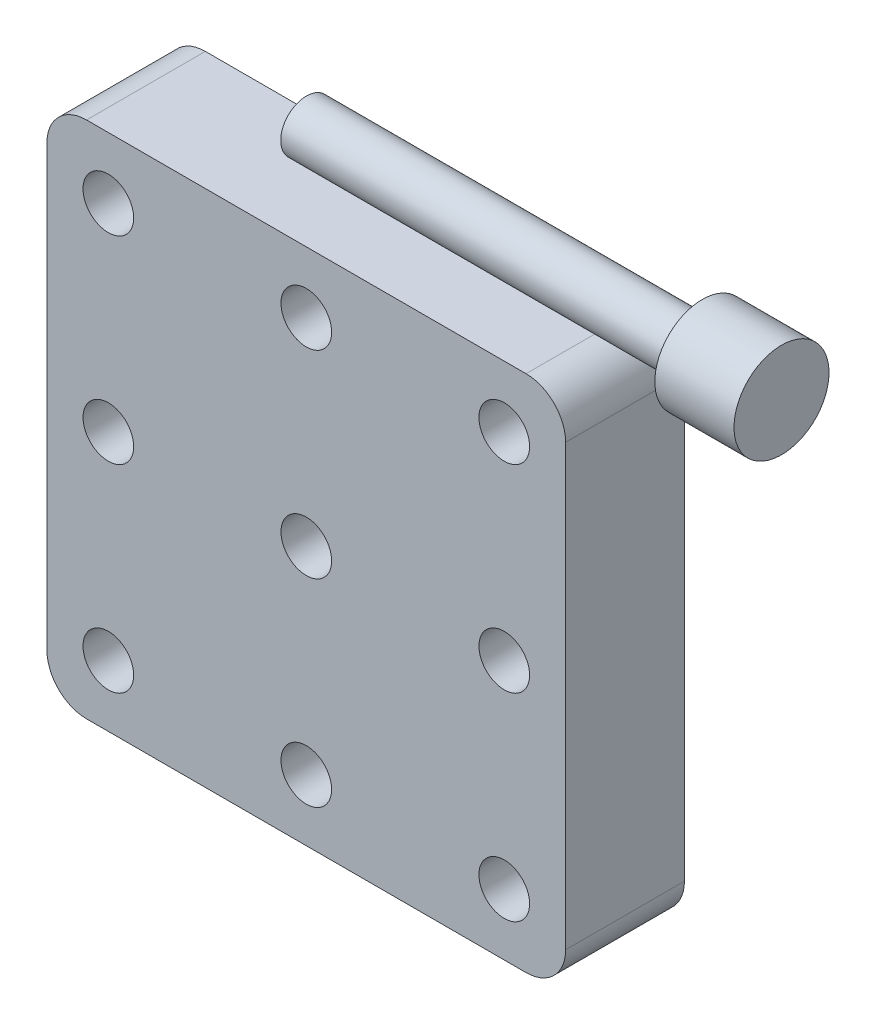
from build123d import *

# Parameters (mm, degrees)
SKETCH_1_W           = 65.5
SKETCH_1_H           = 65.5
EXTRUDE_1_DEPTH      = 20
FILLET_1_R           = 5
EXTRUDE_2_DEPTH      = 40
EXTRUDE_2_DEPTH_BACK = 10
SKETCH_5_R           = 3.245044742
SKETCH_6_R           = 6
EXTRUDE_3_DEPTH      = 10
SKETCH_7_R           = 3.2
CUT_EXTRUDE_2_DEPTH  = 5
CUT_EXTRUDE_START    = -15
SKETCH_3_R           = 3.2
CUT_EXTRUDE_3_DEPTH  = 15
SKETCH_9_W           = 65.5
SKETCH_9_H           = 65.5
CUT_EXTRUDE_5_DEPTH  = 5


with BuildPart() as part:
    # 스케치1 → 보스-돌출1 (new body)
    with BuildSketch(Plane.XY):
        Rectangle(SKETCH_1_W, SKETCH_1_H)
    extrude(amount=EXTRUDE_1_DEPTH)

    # 필렛1
    fillet_1_edges = [part.edges().sort_by_distance(p)[0] for p in [
        (-32.75, -32.75, 10),
        (32.75, -32.75, 10),
        (32.75, 32.75, 10),
        (-32.75, 32.75, 10),
    ]]
    fillet(fillet_1_edges, radius=FILLET_1_R)

    # 스케치7 → 컷-돌출2 (cut)
    with BuildSketch(Plane(origin=(0, 0, 0), x_dir=(-1, 0, 0), z_dir=(0, 0, -1))):
        with Locations((-25, -25)):
            Circle(SKETCH_7_R)
        with Locations((-25, 25)):
            Circle(SKETCH_7_R)
    extrude(amount=-CUT_EXTRUDE_2_DEPTH, mode=Mode.SUBTRACT)

    # 스케치3 → 컷-돌출3 (cut)
    with BuildSketch(Plane.XY.offset(20).offset(CUT_EXTRUDE_START)):
        with Locations(Location((25, -25, 0), (0, 0, 180))):
            Circle(SKETCH_3_R)
        with Locations(Location((25, 25, 0), (0, 0, 180))):
            Circle(SKETCH_3_R)
        with Locations((25, 0)):
            Circle(SKETCH_3_R)
        with Locations((0, -25)):
            Circle(SKETCH_3_R)
        with Locations((0, 25)):
            Circle(SKETCH_3_R)
        Circle(SKETCH_3_R)
        with Locations((-25, -25)):
            Circle(SKETCH_3_R)
        with Locations((-25, 25)):
            Circle(SKETCH_3_R)
        with Locations((-25, 0)):
            Circle(SKETCH_3_R)
    extrude(amount=CUT_EXTRUDE_3_DEPTH, mode=Mode.SUBTRACT)

    # 스케치9 → 컷-돌출5 (cut)
    with BuildSketch(Plane(origin=(0, 0, 0), x_dir=(-1, 0, 0), z_dir=(0, 0, -1))):
        Rectangle(SKETCH_9_W, SKETCH_9_H)
    extrude(amount=-CUT_EXTRUDE_5_DEPTH, mode=Mode.SUBTRACT)


with BuildPart() as body_2:
    # 스케치5 → 보스-돌출2 (new, two sides: drawn at the far end of the back side and taken through both)
    with BuildSketch(Plane(origin=(0, 0, 0), x_dir=(0, 0, -1), z_dir=(1, 0, 0)).offset(-EXTRUDE_2_DEPTH_BACK)):
        with Locations((-9.988036098, 35.995044742)):
            Circle(SKETCH_5_R)
    extrude(amount=EXTRUDE_2_DEPTH + EXTRUDE_2_DEPTH_BACK)

    # 스케치6 → 보스-돌출3 (add)
    with BuildSketch(Plane(origin=(40, 0, 0), x_dir=(0, 0, -1), z_dir=(1, 0, 0))):
        with Locations((-9.988036098, 35.995044742)):
            Circle(SKETCH_6_R)
    extrude(amount=EXTRUDE_3_DEPTH)


solid = Compound([part.part, body_2.part])
